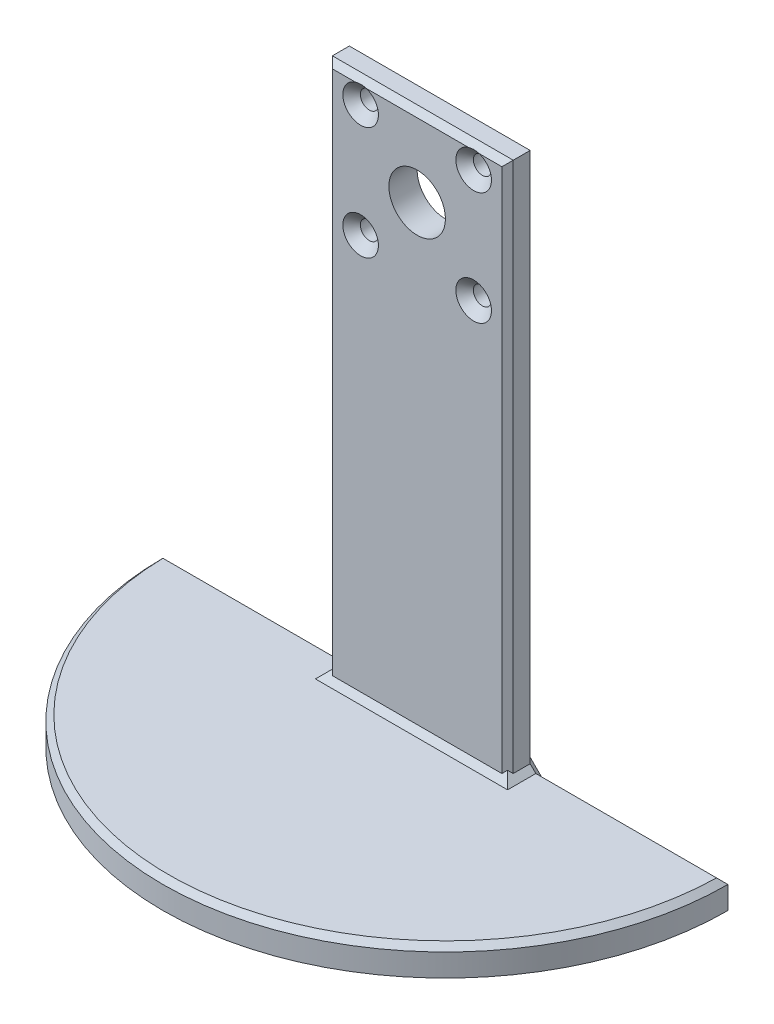
from build123d import *

# Parameters (mm, degrees)
SKIZZE1_R                                            = 5
SKIZZE1_R_2                                          = 1.6
AUFSATZ_LINEAR_AUSTRAGEN1_DEPTH                      = 5
AUFSATZ_LINEAR_AUSTRAGEN2_DEPTH                      = 5
FASE1_SIZE                                           = 1
FASE2_SIZE                                           = 1
FASE3_SIZE                                           = 1
FORMSENKUNG_F_R_M3_LINSENSENKSCHRAUBE_MI_D           = 3.2
FORMSENKUNG_F_R_M3_LINSENSENKSCHRAUBE_MI_CSINK_D     = 6.3
FORMSENKUNG_F_R_M3_LINSENSENKSCHRAUBE_MI_CSINK_ANGLE = 90


with BuildPart() as part:
    # Skizze1 → Aufsatz-Linear austragen1 (new body)
    with BuildSketch(Plane.XY):
        Polygon((16, -13.386681205), (16, 7.597112796), (16, 14), (-16, 14), (-16, 4.559518535), (-16, -16.424275466), (-16, -86), (16, -86), align=None)
        Circle(SKIZZE1_R, mode=Mode.SUBTRACT)
        with Locations((10, -10)):
            Circle(SKIZZE1_R_2, mode=Mode.SUBTRACT)
        with Locations((-10, -10)):
            Circle(SKIZZE1_R_2, mode=Mode.SUBTRACT)
        with Locations((-10, 10)):
            Circle(SKIZZE1_R_2, mode=Mode.SUBTRACT)
        with Locations((10, 10)):
            Circle(SKIZZE1_R_2, mode=Mode.SUBTRACT)
    extrude(amount=AUFSATZ_LINEAR_AUSTRAGEN1_DEPTH)

    # Skizze2 → Aufsatz-Linear austragen2 (add)
    with BuildSketch(Plane(origin=(0, -86, 0), x_dir=(-1, 0, 0), z_dir=(0, -1, 0))):
        with BuildLine():
            Line((50, 0), (16, 0))
            Line((16, 0), (16, -5))
            Line((16, -5), (-16, -5))
            Line((-16, -5), (-16, 0))
            Line((-16, 0), (-50, 0))
            ThreePointArc((-50, 0), (0, -50), (50, 0))
        make_face()
    extrude(amount=-AUFSATZ_LINEAR_AUSTRAGEN2_DEPTH)

    # Fase1
    fase1_edges = [part.edges().sort_by_distance(p)[0] for p in [
        (16, -33.5, 0),
        (33, -81, 0),
        (-33, -81, 0),
        (0, -81, 50),
        (16, -81, 2.5),
        (0, -81, 5),
        (-16, -81, 2.5),
        (-16, -33.5, 0),
    ]]
    chamfer(fase1_edges, length=FASE1_SIZE)

    # Fase2
    fase2_edges = [part.edges().sort_by_distance(p)[0] for p in [
        (0, 14, 5),
        (-16, -33, 5),
        (16, -33, 5),
    ]]
    chamfer(fase2_edges, length=FASE2_SIZE)

    # Fase3
    fase3_edges = [part.edges().sort_by_distance(p)[0] for p in [
        (0, 14, 0),
    ]]
    chamfer(fase3_edges, length=FASE3_SIZE)

    # Formsenkung für M3 Linsensenkschraube mit Schlitz1 (through all)
    with Locations(Plane.XY.offset(5)):
        with Locations((-10, 10), (10, 10), (-10, -10), (10, -10)):
            CounterSinkHole(FORMSENKUNG_F_R_M3_LINSENSENKSCHRAUBE_MI_D / 2, FORMSENKUNG_F_R_M3_LINSENSENKSCHRAUBE_MI_CSINK_D / 2, counter_sink_angle=FORMSENKUNG_F_R_M3_LINSENSENKSCHRAUBE_MI_CSINK_ANGLE)


solid = part.part
